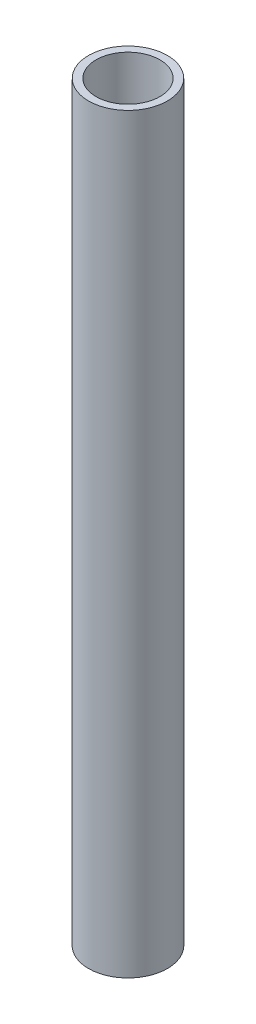
from build123d import *

# Parameters (mm, degrees)
SKETCH1_R           = 10.5
SKETCH1_R_2         = 8.5
BOSS_EXTRUDE1_DEPTH = 200


with BuildPart() as part:
    # Sketch1 → Boss-Extrude1 (new body)
    with BuildSketch(Plane(origin=(0, 0, 0), x_dir=(1, 0, 0), z_dir=(0, 1, 0))):
        with Locations(Location((0, 0, 0), (0, 0, 270))):
            Circle(SKETCH1_R)
        with Locations(Location((0, 0, 0), (0, 0, 270))):
            Circle(SKETCH1_R_2, mode=Mode.SUBTRACT)
    extrude(amount=BOSS_EXTRUDE1_DEPTH)


solid = part.part
